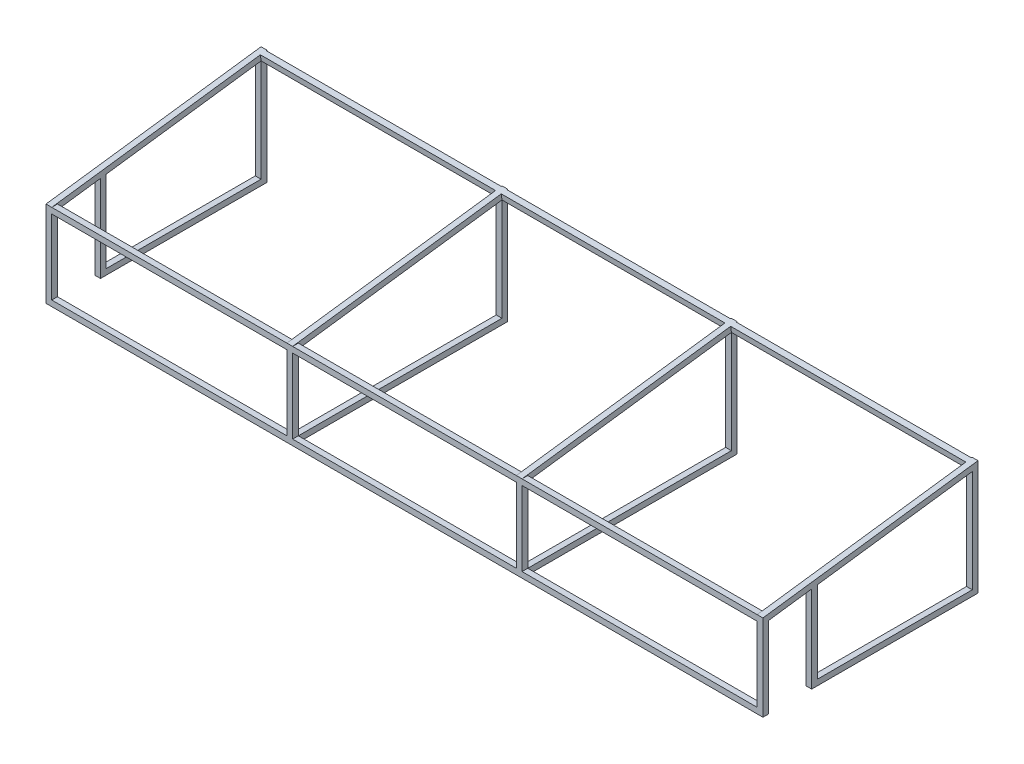
from build123d import *

# Parameters (mm, degrees)
BOSS_EXTRUDE2_START  = 1250
BOSS_EXTRUDE2_DEPTH  = 20
SKETCH3_W            = 20
SKETCH3_H            = 20
BOSS_EXTRUDE3_DEPTH  = 1250
LPATTERN1_COUNT      = 2
LPATTERN1_PITCH      = 840
MIRROR1_START        = 1250
MIRROR1_COPY_1_DEPTH = 20
SKETCH6_W            = 20
SKETCH6_H            = 20
BOSS_EXTRUDE7_DEPTH  = 730
SKETCH7_W            = 20
SKETCH7_H            = 379.823005399
BOSS_EXTRUDE8_DEPTH  = 20
CUT_EXTRUDE2_DEPTH   = 20
SKETCH10_W           = 20
SKETCH10_H           = 305.156338733
BOSS_EXTRUDE9_DEPTH  = 20
SKETCH11_W           = 150
SKETCH11_H           = 20
CUT_EXTRUDE3_DEPTH   = 20
BOSS_EXTRUDE10_DEPTH = 20


with BuildPart() as part:
    # Sketch2 → Boss-Extrude2 (new body)
    with BuildSketch(Plane(origin=(0, 0, 0), x_dir=(0, 0, -1), z_dir=(1, 0, 0)).offset(BOSS_EXTRUDE2_START)):
        Polygon((-2.643274402, -0.352436587), (-750, -100), (-750, -400), (-730, -400), (-730, -117.510327934), (0, -20.176994601), (0, 0), align=None)
    boss_extrude2 = extrude(amount=-BOSS_EXTRUDE2_DEPTH)

    # Sketch3 → Boss-Extrude3 (add, symmetric)
    with BuildSketch(Plane(origin=(0, 0, 0), x_dir=(0, 0, -1), z_dir=(1, 0, 0))):
        Polygon((0, -20.176994601), (-2.643274402, -0.352436587), (-22.467832415, -2.995710989), (-19.824558014, -22.820269002), align=None)
        with Locations((-740, -390)):
            Rectangle(SKETCH3_W, SKETCH3_H)
        with Locations((-740, -110)):
            Rectangle(SKETCH3_W, SKETCH3_H)
    extrude(amount=BOSS_EXTRUDE3_DEPTH, both=True)

    # LPattern1: Boss-Extrude2 ×2
    with Locations(*[(-i * LPATTERN1_PITCH, 0, 0) for i in range(1, LPATTERN1_COUNT)]):
        add(boss_extrude2)

    # Mirror1: Boss-Extrude2 across plane
    add(boss_extrude2.mirror(Plane(origin=(0, 0, 0), x_dir=(0, 0, 1), z_dir=(1, 0, 0))))

    # Mirror1 copy 1 sketch → Mirror1 copy 1 (add)
    with BuildSketch(Plane(origin=(840, 0, 0), x_dir=(0, 0, -1), z_dir=(-1, 0, 0)).offset(MIRROR1_START)):
        Polygon((-2.643274402, 0.352436587), (-750, 100), (-750, 400), (-730, 400), (-730, 117.510327934), (0, 20.176994601), (0, 0), align=None)
    extrude(amount=-MIRROR1_COPY_1_DEPTH)

    # Sketch6 → Boss-Extrude7 (add, through all)
    with BuildSketch(Plane(origin=(0, 0, 730), x_dir=(-1, 0, 0), z_dir=(0, 0, -1))):
        with Locations((-400, -390)):
            Rectangle(SKETCH6_W, SKETCH6_H)
        with Locations((400, -390)):
            Rectangle(SKETCH6_W, SKETCH6_H)
        with Locations((-1240, -390)):
            Rectangle(SKETCH6_W, SKETCH6_H)
        with Locations((1240, -390)):
            Rectangle(SKETCH6_W, SKETCH6_H)
    extrude(amount=BOSS_EXTRUDE7_DEPTH)

    # Sketch7 → Boss-Extrude8 (add)
    with BuildSketch(Plane(origin=(0, 0, 0), x_dir=(-1, 0, 0), z_dir=(0, 0, -1))):
        with Locations((-1240, -210.0884973)):
            Rectangle(SKETCH7_W, SKETCH7_H)
        with Locations((-400, -210.0884973)):
            Rectangle(SKETCH7_W, SKETCH7_H)
        with Locations((400, -210.0884973)):
            Rectangle(SKETCH7_W, SKETCH7_H)
        with Locations((1240, -210.0884973)):
            Rectangle(SKETCH7_W, SKETCH7_H)
    extrude(amount=-BOSS_EXTRUDE8_DEPTH)

    # Sketch9 → Cut-Extrude2 (cut)
    with BuildSketch(Plane.ZY.offset(1250)):
        Polygon((0, -400), (730, -400), (730, -117.510327934), (20, -22.843661267), (0, -20.176994601), align=None)
    extrude(amount=-CUT_EXTRUDE2_DEPTH, mode=Mode.SUBTRACT)

    # Sketch10 → Boss-Extrude9 (add)
    with BuildSketch(Plane(origin=(1250, 0, 0), x_dir=(0, 0, -1), z_dir=(1, 0, 0))):
        with Locations((-570, -247.421830634)):
            Rectangle(SKETCH10_W, SKETCH10_H)
    extrude(amount=-BOSS_EXTRUDE9_DEPTH)

    # Sketch11 → Cut-Extrude3 (cut)
    with BuildSketch(Plane(origin=(1250, 0, 0), x_dir=(0, 0, -1), z_dir=(1, 0, 0))):
        with Locations((-655, -390)):
            Rectangle(SKETCH11_W, SKETCH11_H)
    extrude(amount=-CUT_EXTRUDE3_DEPTH, mode=Mode.SUBTRACT)

    # Sketch12 → Boss-Extrude10 (add)
    with BuildSketch(Plane.ZY.offset(1250)):
        Polygon((0, -20.176994601), (20, -20.176994601), (20, -380), (560, -380), (560, -94.843661267), (580, -94.843661267), (580, -400), (0, -400), align=None)
    extrude(amount=-BOSS_EXTRUDE10_DEPTH)


solid = part.part
